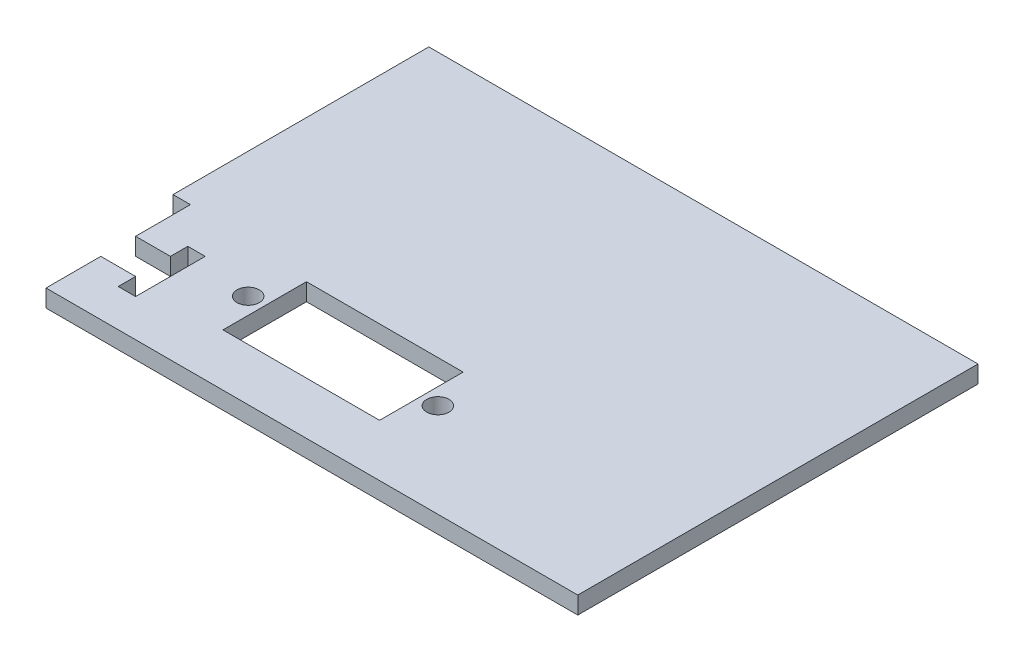
from build123d import *

# Parameters (mm, degrees)
SKETCH1_W               = 80
SKETCH1_H               = 60
BOSS_EXTRUDE1_DEPTH     = 2.5
CUT_EXTRUDE4_DEPTH      = 51.062460986
CUT_EXTRUDE4_DEPTH_BACK = 51.062460986
SKETCH2_R               = 1.6
SKETCH3_W               = 2.5
SKETCH3_H               = 20.5
BOSS_EXTRUDE2_DEPTH     = 66.5
SKETCH4_W               = 80
SKETCH4_H               = 5.5
BOSS_EXTRUDE3_DEPTH     = 2.5
SKETCH5_W               = 2.5
SKETCH5_H               = 5.5
BOSS_EXTRUDE4_DEPTH     = 66.5
SKETCH6_W               = 2.5
SKETCH6_H               = 5.5
CUT_EXTRUDE5_DEPTH      = 66.5
SKETCH9_W               = 2.5
SKETCH9_H               = 2.5
BOSS_EXTRUDE5_DEPTH     = 66.5
SKETCH11_R              = 4.75
CUT_EXTRUDE6_DEPTH      = 2.5
SKETCH15_W              = 2.5
SKETCH15_H              = 23
BOSS_EXTRUDE6_DEPTH     = 8
SKETCH17_W              = 2.5
SKETCH17_H              = 74.5
BOSS_EXTRUDE7_DEPTH     = 2
SKETCH18_R              = 1.6
CUT_EXTRUDE7_DEPTH      = 2.5
SKETCH21_W              = 80
SKETCH21_H              = 2.5
BOSS_EXTRUDE8_DEPTH     = 2
SKETCH22_W              = 4.25
SKETCH22_H              = 74.5
CUT_EXTRUDE8_DEPTH      = 2.5
FILLET1_R               = 5
SKETCH23_W              = 15.225
SKETCH23_H              = 67.5
BOSS_EXTRUDE10_DEPTH    = 2.5
SKETCH24_W              = 95.225
SKETCH24_H              = 10
CUT_EXTRUDE9_DEPTH      = 101.031498164
SKETCH26_W              = 2.5
SKETCH26_H              = 20.75
BOSS_EXTRUDE11_DEPTH    = 74.5
SKETCH27_R              = 1.6
CUT_EXTRUDE10_DEPTH     = 2.5
SKETCH28_W              = 2.5
SKETCH28_H              = 20.75
CUT_EXTRUDE11_DEPTH     = 74.5
SKETCH29_W              = 20.75
SKETCH29_H              = 19.625
CUT_EXTRUDE12_DEPTH     = 2.5
FILLET2_R               = 6
SKETCH31_W              = 13.325
SKETCH31_H              = 57.5
CUT_EXTRUDE13_DEPTH     = 2.5
SKETCH33_W              = 3
SKETCH33_H              = 57.5
CUT_EXTRUDE14_DEPTH     = 2.5
CUT_EXTRUDE15_DEPTH     = 2.5
SKETCH35_W              = 2.5
SKETCH35_H              = 20.75
CUT_EXTRUDE16_DEPTH     = 57.375


with BuildPart() as part:
    # Sketch1 → Boss-Extrude1 (new body)
    with BuildSketch(Plane(origin=(0, 0, 0), x_dir=(1, 0, 0), z_dir=(0, 1, 0))):
        Rectangle(SKETCH1_W, SKETCH1_H)
    extrude(amount=BOSS_EXTRUDE1_DEPTH)

    # Sketch2 → Cut-Extrude4 (cut, two sides: drawn at the far end of the back side and taken through both)
    with BuildSketch(Plane(origin=(0, 0, 0), x_dir=(1, 0, 0), z_dir=(0, 1, 0)).offset(-CUT_EXTRUDE4_DEPTH_BACK)):
        with BuildLine():
            Line((-6.25, -24), (-2.5, -24))
            ThreePointArc((-2.5, -24), (0, -21.5), (2.5, -24))
            Line((2.5, -24), (16.25, -24))
            Line((16.25, -24), (16.25, -18))
            Line((16.25, -18), (-6.25, -18))
            Line((-6.25, -18), (-6.25, -24))
        make_face()
        with BuildLine():
            Line((0, -26.5), (0, -30))
            Line((0, -30), (16.25, -30))
            Line((16.25, -30), (16.25, -24))
            Line((16.25, -24), (2.5, -24))
            ThreePointArc((2.5, -24), (1.767766953, -25.767766953), (0, -26.5))
        make_face()
        with BuildLine():
            ThreePointArc((-2.5, -24), (-1.767766953, -25.767766953), (0, -26.5))
            Line((0, -26.5), (0, -24))
            Line((0, -24), (-2.5, -24))
        make_face()
        with BuildLine():
            Line((0, -24), (0, -26.5))
            ThreePointArc((0, -26.5), (1.767766953, -25.767766953), (2.5, -24))
            Line((2.5, -24), (0, -24))
        make_face()
        with BuildLine():
            Line((-2.5, -24), (0, -24))
            Line((0, -24), (2.5, -24))
            ThreePointArc((2.5, -24), (0, -21.5), (-2.5, -24))
        make_face()
        with BuildLine():
            ThreePointArc((-2.5, -24), (-1.767766953, -25.767766953), (0, -26.5))
            Line((0, -26.5), (0, -24))
            Line((0, -24), (-2.5, -24))
        make_face()
        with BuildLine():
            Line((0, -24), (0, -26.5))
            ThreePointArc((0, -26.5), (1.767766953, -25.767766953), (2.5, -24))
            Line((2.5, -24), (0, -24))
        make_face()
        with BuildLine():
            Line((-6.25, -30), (0, -30))
            Line((0, -30), (0, -26.5))
            ThreePointArc((0, -26.5), (-1.767766953, -25.767766953), (-2.5, -24))
            Line((-2.5, -24), (-6.25, -24))
            Line((-6.25, -24), (-6.25, -30))
        make_face()
        with Locations(Location((-8.625, -24, 0), (0, 0, 270))):
            Circle(SKETCH2_R)
        with Locations(Location((18.625, -24, 0), (0, 0, 270))):
            Circle(SKETCH2_R)
    extrude(amount=CUT_EXTRUDE4_DEPTH + CUT_EXTRUDE4_DEPTH_BACK, mode=Mode.SUBTRACT)

    # Sketch3 → Boss-Extrude2 (add)
    with BuildSketch(Plane(origin=(0, 2.5, 0), x_dir=(1, 0, 0), z_dir=(0, 1, 0))):
        with Locations((-38.75, -19.75)):
            Rectangle(SKETCH3_W, SKETCH3_H)
    extrude(amount=BOSS_EXTRUDE2_DEPTH)

    # Sketch4 → Boss-Extrude3 (add)
    with BuildSketch(Plane(origin=(0, 2.5, 0), x_dir=(1, 0, 0), z_dir=(0, 1, 0))):
        with Locations((0, -32.75)):
            Rectangle(SKETCH4_W, SKETCH4_H)
    extrude(amount=-BOSS_EXTRUDE3_DEPTH)

    # Sketch5 → Boss-Extrude4 (add)
    with BuildSketch(Plane(origin=(0, 2.5, 0), x_dir=(1, 0, 0), z_dir=(0, 1, 0))):
        with Locations((-38.75, -32.75)):
            Rectangle(SKETCH5_W, SKETCH5_H)
    extrude(amount=BOSS_EXTRUDE4_DEPTH)

    # Sketch6 → Cut-Extrude5 (cut)
    with BuildSketch(Plane(origin=(0, 69, 0), x_dir=(1, 0, 0), z_dir=(0, 1, 0))):
        with Locations((-38.75, -12.25)):
            Rectangle(SKETCH6_W, SKETCH6_H)
    extrude(amount=-CUT_EXTRUDE5_DEPTH, mode=Mode.SUBTRACT)

    # Sketch9 → Boss-Extrude5 (add)
    with BuildSketch(Plane(origin=(0, 2.5, 0), x_dir=(1, 0, 0), z_dir=(0, 1, 0))):
        with Locations((-38.75, -13.75)):
            Rectangle(SKETCH9_W, SKETCH9_H)
    extrude(amount=BOSS_EXTRUDE5_DEPTH)

    # Sketch11 → Cut-Extrude6 (cut)
    with BuildSketch(Plane(origin=(-37.5, 0, 0), x_dir=(0, 0, -1), z_dir=(1, 0, 0))):
        with Locations((-24, 54)):
            Circle(SKETCH11_R)
    extrude(amount=-CUT_EXTRUDE6_DEPTH, mode=Mode.SUBTRACT)

    # Sketch15 → Boss-Extrude6 (add)
    with BuildSketch(Plane(origin=(0, 69, 0), x_dir=(1, 0, 0), z_dir=(0, 1, 0))):
        with Locations((-38.75, -24)):
            Rectangle(SKETCH15_W, SKETCH15_H)
    extrude(amount=BOSS_EXTRUDE6_DEPTH)

    # Sketch17 → Boss-Extrude7 (add)
    with BuildSketch(Plane.XY.offset(35.5)):
        with Locations((-38.75, 39.75)):
            Rectangle(SKETCH17_W, SKETCH17_H)
    extrude(amount=BOSS_EXTRUDE7_DEPTH)

    # Sketch18 → Cut-Extrude7 (cut)
    with BuildSketch(Plane.ZY.offset(40)):
        with Locations((32, 36.5)):
            Circle(SKETCH18_R)
        with Locations((32, 71.5)):
            Circle(SKETCH18_R)
    extrude(amount=-CUT_EXTRUDE7_DEPTH, mode=Mode.SUBTRACT)

    # Sketch21 → Boss-Extrude8 (add)
    with BuildSketch(Plane.XY.offset(35.5)):
        with Locations((0, 1.25)):
            Rectangle(SKETCH21_W, SKETCH21_H)
    extrude(amount=BOSS_EXTRUDE8_DEPTH)

    # Sketch22 → Cut-Extrude8 (cut)
    with BuildSketch(Plane(origin=(-37.5, 0, 0), x_dir=(0, 0, -1), z_dir=(1, 0, 0))):
        with Locations((-14.625, 39.75)):
            Rectangle(SKETCH22_W, SKETCH22_H)
    extrude(amount=-CUT_EXTRUDE8_DEPTH, mode=Mode.SUBTRACT)

    # Fillet1
    fillet1_edges = [part.edges().sort_by_distance(p)[0] for p in [
        (-38.75, 77, 37.5),
        (-38.75, 77, 16.75),
    ]]
    fillet(fillet1_edges, radius=FILLET1_R)

    # Sketch23 → Boss-Extrude10 (add)
    with BuildSketch(Plane(origin=(0, 2.5, 0), x_dir=(1, 0, 0), z_dir=(0, 1, 0))):
        with Locations((47.6125, -3.75)):
            Rectangle(SKETCH23_W, SKETCH23_H)
    extrude(amount=-BOSS_EXTRUDE10_DEPTH)

    # Sketch24 → Cut-Extrude9 (cut, through all)
    with BuildSketch(Plane(origin=(0, 2.5, 0), x_dir=(1, 0, 0), z_dir=(0, 1, 0))):
        with Locations((7.6125, 25)):
            Rectangle(SKETCH24_W, SKETCH24_H)
    extrude(amount=-CUT_EXTRUDE9_DEPTH, mode=Mode.SUBTRACT)

    # Sketch26 → Boss-Extrude11 (add)
    with BuildSketch(Plane(origin=(0, 2.5, 0), x_dir=(1, 0, 0), z_dir=(0, 1, 0))):
        with Locations((-25.425, -27.125)):
            Rectangle(SKETCH26_W, SKETCH26_H)
    extrude(amount=BOSS_EXTRUDE11_DEPTH)

    # Sketch27 → Cut-Extrude10 (cut)
    with BuildSketch(Plane(origin=(-24.175, 0, 0), x_dir=(0, 0, -1), z_dir=(1, 0, 0))):
        with BuildLine():
            ThreePointArc((-28.75, 36.275), (-27.358757211, 32.916242789), (-24, 31.525))
            Line((-24, 31.525), (-24, 36.275))
            Line((-24, 36.275), (-28.75, 36.275))
        make_face()
        with BuildLine():
            Line((-24, 36.275), (-24, 31.525))
            ThreePointArc((-24, 31.525), (-20.641242789, 32.916242789), (-19.25, 36.275))
            ThreePointArc((-19.25, 36.275), (-24, 41.025), (-28.75, 36.275))
            Line((-28.75, 36.275), (-24, 36.275))
        make_face()
        with BuildLine():
            ThreePointArc((-28.75, 36.275), (-27.358757211, 32.916242789), (-24, 31.525))
            Line((-24, 31.525), (-24, 36.275))
            Line((-24, 36.275), (-28.75, 36.275))
        make_face()
        with BuildLine():
            Line((-24, 36.275), (-24, 31.525))
            ThreePointArc((-24, 31.525), (-20.641242789, 32.916242789), (-19.25, 36.275))
            ThreePointArc((-19.25, 36.275), (-24, 41.025), (-28.75, 36.275))
            Line((-28.75, 36.275), (-24, 36.275))
        make_face()
        with Locations((-32, 18.775)):
            Circle(SKETCH27_R)
        with Locations((-32, 53.775)):
            Circle(SKETCH27_R)
    extrude(amount=-CUT_EXTRUDE10_DEPTH, mode=Mode.SUBTRACT)

    # Sketch28 → Cut-Extrude11 (cut)
    with BuildSketch(Plane(origin=(0, 77, 0), x_dir=(1, 0, 0), z_dir=(0, 1, 0))):
        with Locations((-38.75, -27.125)):
            Rectangle(SKETCH28_W, SKETCH28_H)
    extrude(amount=-CUT_EXTRUDE11_DEPTH, mode=Mode.SUBTRACT)

    # Sketch29 → Cut-Extrude12 (cut)
    with BuildSketch(Plane(origin=(-24.175, 0, 0), x_dir=(0, 0, -1), z_dir=(1, 0, 0))):
        with Locations((-27.125, 67.1875)):
            Rectangle(SKETCH29_W, SKETCH29_H)
    extrude(amount=-CUT_EXTRUDE12_DEPTH, mode=Mode.SUBTRACT)

    # Fillet2
    fillet2_edges = [part.edges().sort_by_distance(p)[0] for p in [
        (-25.425, 57.375, 37.5),
        (-25.425, 57.375, 16.75),
    ]]
    fillet(fillet2_edges, radius=FILLET2_R)

    # Sketch31 → Cut-Extrude13 (cut)
    with BuildSketch(Plane(origin=(0, 2.5, 0), x_dir=(1, 0, 0), z_dir=(0, 1, 0))):
        with Locations((-33.3375, -8.75)):
            Rectangle(SKETCH31_W, SKETCH31_H)
    extrude(amount=-CUT_EXTRUDE13_DEPTH, mode=Mode.SUBTRACT)

    # Sketch33 → Cut-Extrude14 (cut)
    with BuildSketch(Plane(origin=(0, 2.5, 0), x_dir=(1, 0, 0), z_dir=(0, 1, 0))):
        with Locations((53.725, -8.75)):
            Rectangle(SKETCH33_W, SKETCH33_H)
    extrude(amount=-CUT_EXTRUDE14_DEPTH, mode=Mode.SUBTRACT)

    # Sketch34 → Cut-Extrude15 (cut)
    with BuildSketch(Plane(origin=(0, 2.5, 0), x_dir=(1, 0, 0), z_dir=(0, 1, 0))):
        Polygon((-24.175, -24.625), (-24.175, -27.125), (-24.175, -29.625), (-19.175, -29.625), (-19.175, -24.625), align=None)
        Polygon((-19.175, -22.125), (-19.175, -24.625), (-19.175, -29.625), (-19.175, -32.125), (-16.675, -32.125), (-16.675, -22.125), align=None)
    extrude(amount=-CUT_EXTRUDE15_DEPTH, mode=Mode.SUBTRACT)

    # Sketch35 → Cut-Extrude16 (cut)
    with BuildSketch(Plane(origin=(0, 57.375, 0), x_dir=(1, 0, 0), z_dir=(0, 1, 0))):
        with Locations((-25.425, -27.125)):
            Rectangle(SKETCH35_W, SKETCH35_H)
    extrude(amount=-CUT_EXTRUDE16_DEPTH, mode=Mode.SUBTRACT)


solid = part.part
